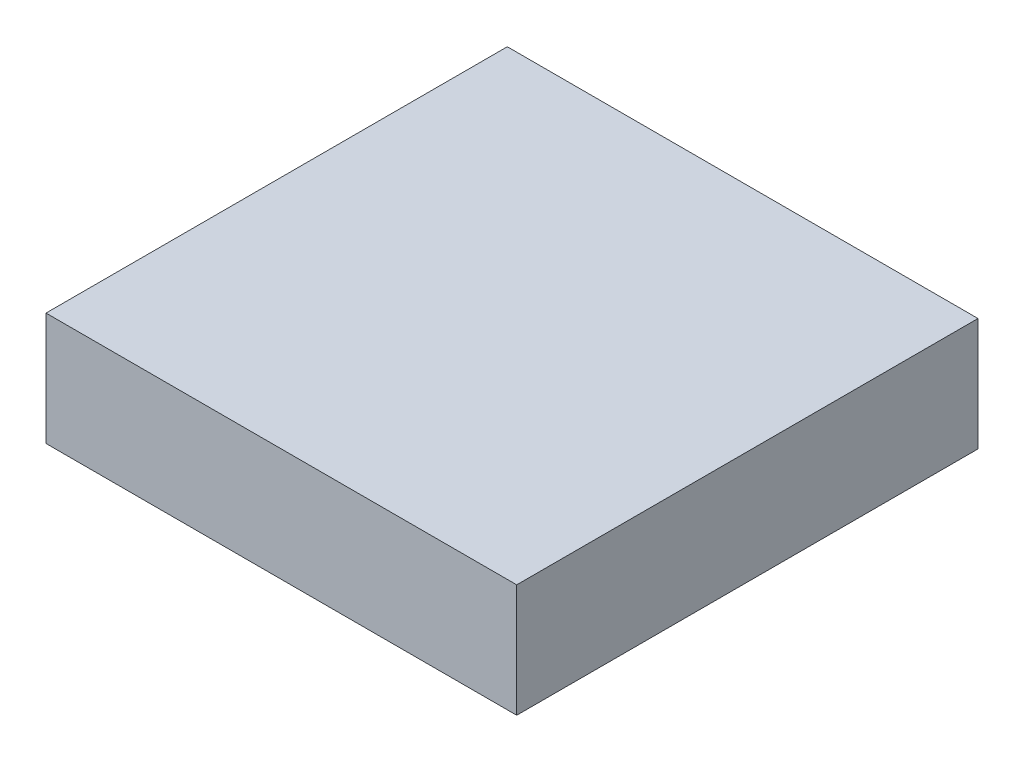
from build123d import *

# Parameters (mm, degrees)
CROQUIS1_W              = 100
CROQUIS1_H              = 98
SALIENTE_EXTRUIR1_DEPTH = 24


with BuildPart() as part:
    # Croquis1 → Saliente-Extruir1 (new body)
    with BuildSketch(Plane(origin=(734.190637124, -662.133069257, 235.423920372), x_dir=(1, 0, 0), z_dir=(0, 1, 0))):
        with Locations((61.902057406, -0.91740413)):
            Rectangle(CROQUIS1_W, CROQUIS1_H)
    extrude(amount=SALIENTE_EXTRUIR1_DEPTH)


solid = part.part
